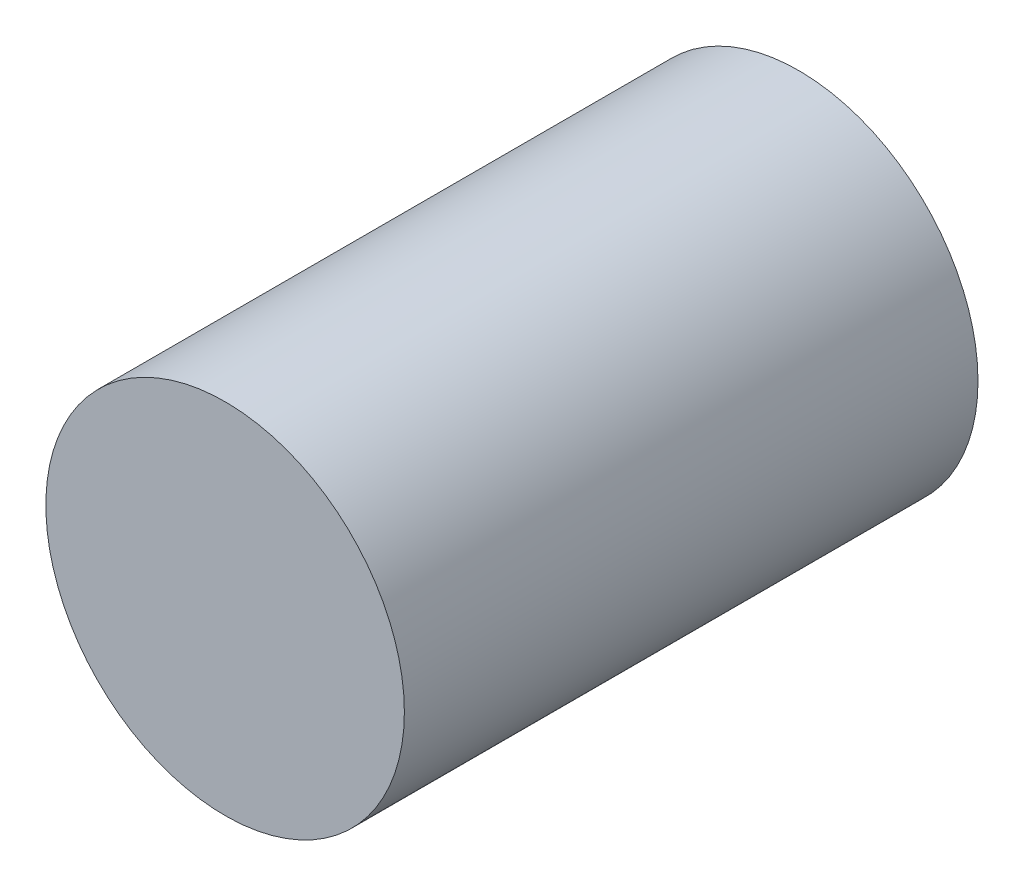
from build123d import *

# Parameters (mm, degrees)
CROQUIS1_R              = 7.5
SALIENTE_EXTRUIR1_DEPTH = 24


with BuildPart() as part:
    # Croquis1 → Saliente-Extruir1 (new body)
    with BuildSketch(Plane.XY):
        Circle(CROQUIS1_R)
    extrude(amount=SALIENTE_EXTRUIR1_DEPTH)


solid = part.part
